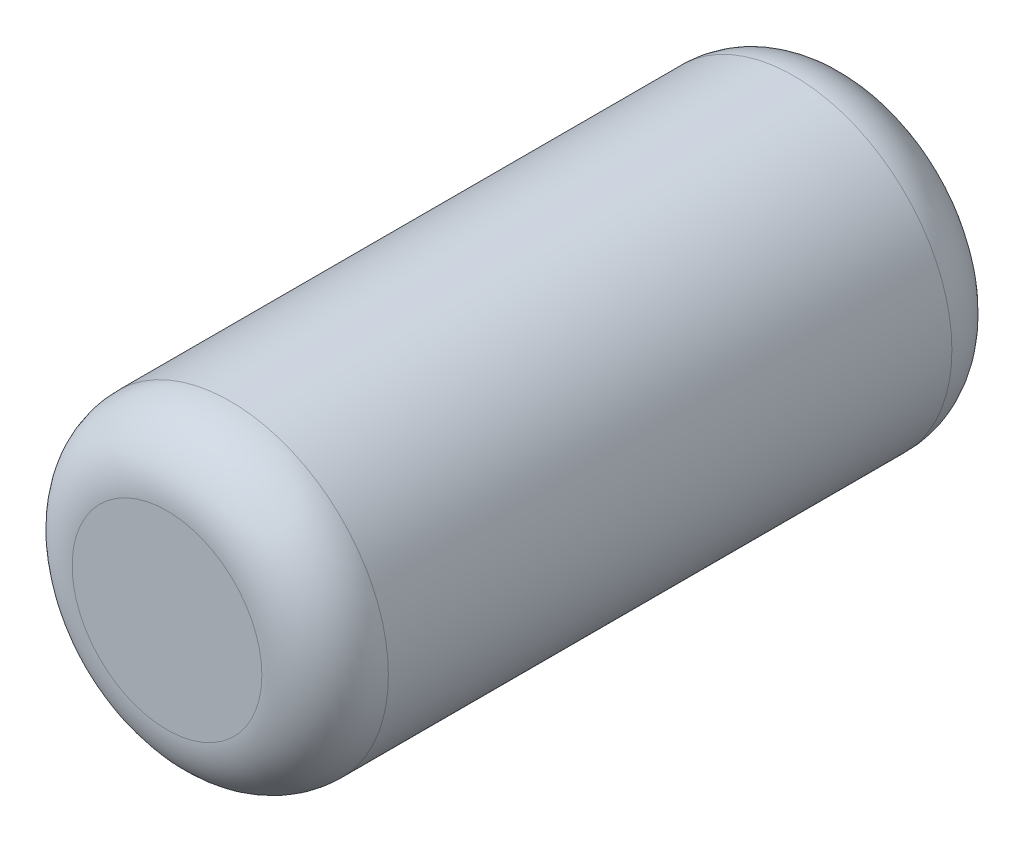
from build123d import *

# Parameters (mm, degrees)
SKETCH1_R           = 34.925
BOSS_EXTRUDE1_DEPTH = 152.4
FILLET1_R           = 13.97


with BuildPart() as part:
    # Sketch1 → Boss-Extrude1 (new body)
    with BuildSketch(Plane.XY):
        with Locations(Location((0, 0, 0), (0, 0, 180))):
            Circle(SKETCH1_R)
    extrude(amount=BOSS_EXTRUDE1_DEPTH)

    # Fillet1
    fillet1_edges = [part.edges().sort_by_distance(p)[0] for p in [
        (34.925, 0, 0),
        (34.925, 0, 152.4),
    ]]
    fillet(fillet1_edges, radius=FILLET1_R)


solid = part.part
